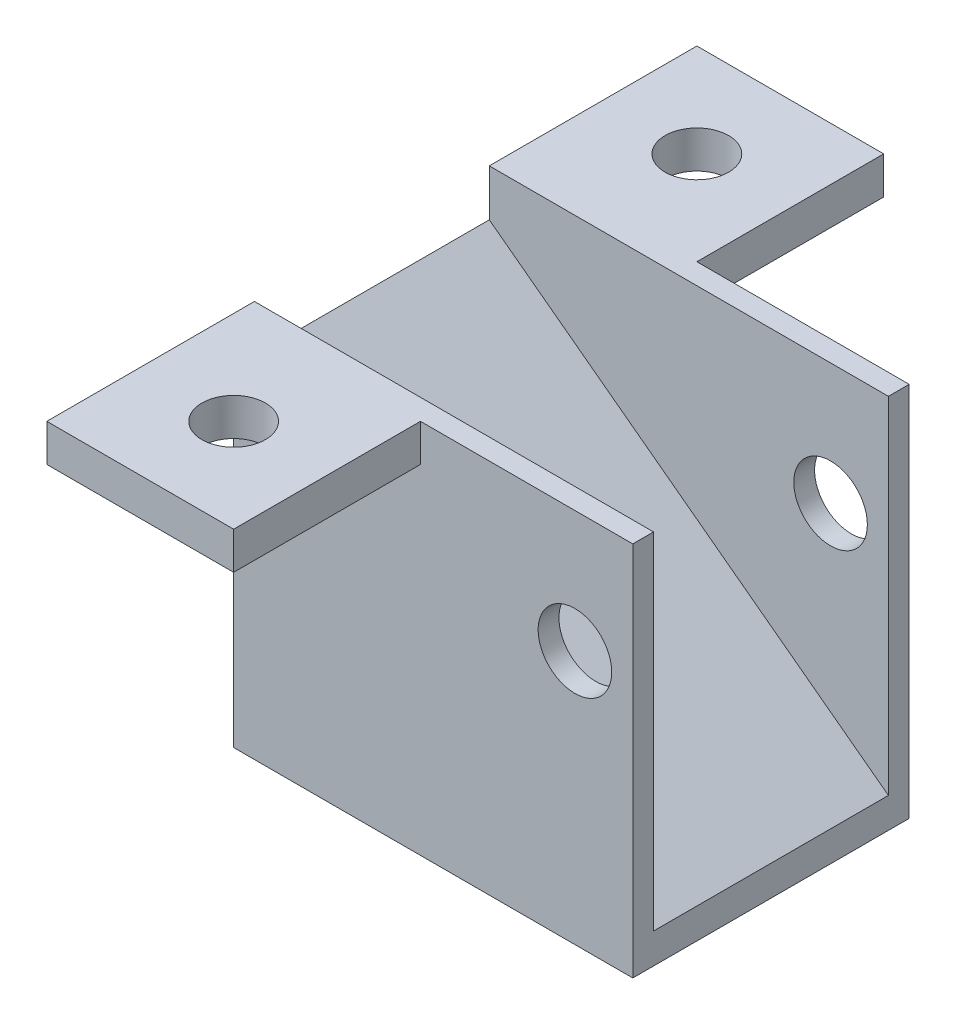
from build123d import *

# Parameters (mm, degrees)
BOSS_EXTRUDE6_DEPTH  = 2.05994
SKETCH9_W            = 27.13228
SKETCH9_H            = 1.41224
BOSS_EXTRUDE7_DEPTH  = 20.32
SKETCH10_R           = 2.50063
CUT_EXTRUDE3_DEPTH   = 25.4
BOSS_EXTRUDE10_DEPTH = 16.02994
SKETCH15_W           = 51.72964
SKETCH15_H           = 37.846
CUT_EXTRUDE5_DEPTH   = 64.999044225
SKETCH16_W           = 27.13228
SKETCH16_H           = 1.41224
BOSS_EXTRUDE11_DEPTH = 3.175
SKETCH18_W           = 12.7
SKETCH18_H           = 2.54
BOSS_EXTRUDE12_DEPTH = 12.7
SKETCH19_R           = 2.159
CUT_EXTRUDE6_DEPTH   = 62.075806811


with BuildPart() as part:
    # Sketch8 → Boss-Extrude6 (new body)
    with BuildSketch(Plane(origin=(0, 0, 0), x_dir=(1, 0, 0), z_dir=(0, 1, 0))):
        Polygon((-44.974060072, -2.900891689), (-44.974060072, -40.746891689), (2.165799928, -40.746891689), (2.165799928, -35.808024144), (6.755579928, -31.218244144), (33.887859928, -31.218244144), (33.887859928, -12.429539234), (6.755579928, -12.429539234), (2.165799928, -7.839759234), (2.165799928, -2.900891689), align=None)
    extrude(amount=BOSS_EXTRUDE6_DEPTH)

    # Sketch9 → Boss-Extrude7 (add)
    with BuildSketch(Plane(origin=(0, 2.05994, 0), x_dir=(1, 0, 0), z_dir=(0, 1, 0))):
        with Locations((20.321719928, -13.135659234)):
            Rectangle(SKETCH9_W, SKETCH9_H)
        with Locations((20.321719928, -30.512124144)):
            Rectangle(SKETCH9_W, SKETCH9_H)
    extrude(amount=BOSS_EXTRUDE7_DEPTH)

    # Sketch10 → Cut-Extrude3 (cut)
    with BuildSketch(Plane.XY.offset(31.218244144)):
        with Locations((29.955939928, 17.2847)):
            Circle(SKETCH10_R)
    extrude(amount=-CUT_EXTRUDE3_DEPTH, mode=Mode.SUBTRACT)

    # Sketch14 → Boss-Extrude10 (add)
    with BuildSketch(Plane.XY.offset(13.841779234)):
        Polygon((6.755579928, 22.37994), (33.887859928, 2.05994), (30.568919609, 2.05994), (6.755579928, 19.826826768), align=None)
    extrude(amount=BOSS_EXTRUDE10_DEPTH)

    # Sketch15 → Cut-Extrude5 (cut, through all)
    with BuildSketch(Plane(origin=(0, 2.05994, 0), x_dir=(1, 0, 0), z_dir=(0, 1, 0))):
        with Locations((-19.109240072, -21.823891689)):
            Rectangle(SKETCH15_W, SKETCH15_H)
    extrude(amount=-CUT_EXTRUDE5_DEPTH, mode=Mode.SUBTRACT)

    # Sketch16 → Boss-Extrude11 (add)
    with BuildSketch(Plane(origin=(0, 22.37994, 0), x_dir=(1, 0, 0), z_dir=(0, 1, 0))):
        with Locations((20.321719928, -30.512124144)):
            Rectangle(SKETCH16_W, SKETCH16_H)
        with Locations((20.321719928, -13.135659234)):
            Rectangle(SKETCH16_W, SKETCH16_H)
    extrude(amount=BOSS_EXTRUDE11_DEPTH)

    # Sketch18 → Boss-Extrude12 (add)
    with BuildSketch(Plane.XY.offset(31.218244144)):
        with Locations((13.105579928, 24.28494)):
            Rectangle(SKETCH18_W, SKETCH18_H)
    boss_extrude12 = extrude(amount=BOSS_EXTRUDE12_DEPTH)

    # Mirror1: Boss-Extrude12 across plane
    add(boss_extrude12.mirror(Plane.XY.offset(21.823891689)))

    # Sketch19 → Cut-Extrude6 (cut, through all)
    with BuildSketch(Plane(origin=(0, 25.55494, 0), x_dir=(1, 0, 0), z_dir=(0, 1, 0))):
        with Locations(Location((13.105579928, -6.079539234, 0), (0, 0, 270))):
            Circle(SKETCH19_R)
        with Locations(Location((13.105579928, -37.568244144, 0), (0, 0, 270))):
            Circle(SKETCH19_R)
    extrude(amount=-CUT_EXTRUDE6_DEPTH, mode=Mode.SUBTRACT)


solid = part.part
